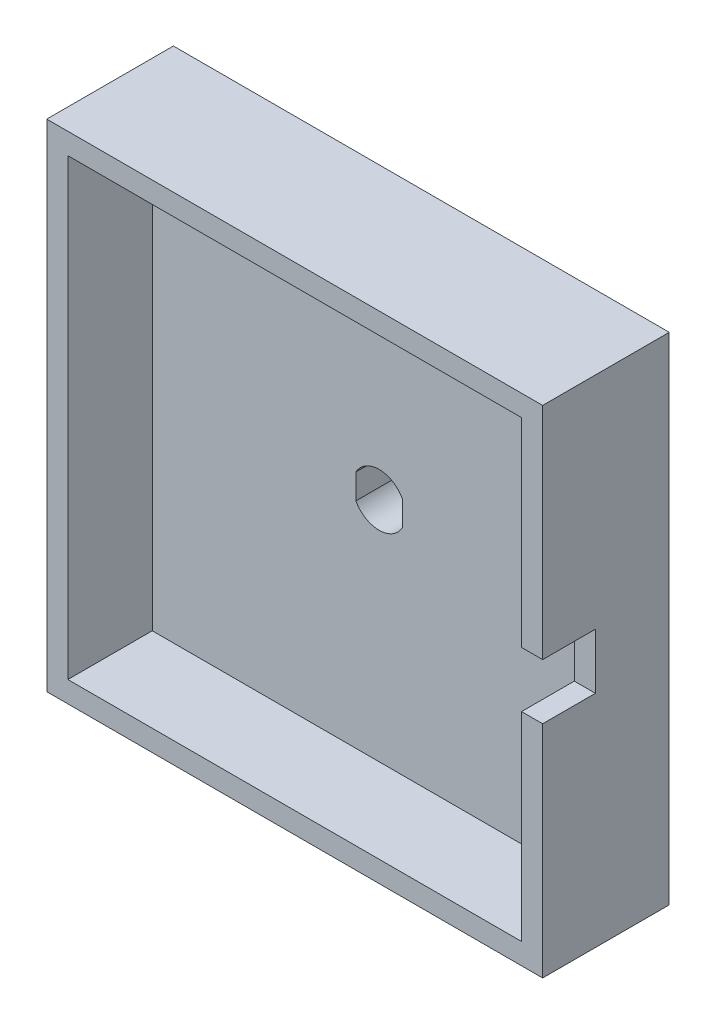
from build123d import *

# Parameters (mm, degrees)
SKETCH1_W               = 47
SKETCH1_H               = 47
BOSS_EXTRUDE1_DEPTH     = 4
CUT_EXTRUDE1_DEPTH      = 34.473870407
CUT_EXTRUDE1_DEPTH_BACK = 34.473870407
CUT_EXTRUDE2_DEPTH      = 34.473870407
CUT_EXTRUDE2_DEPTH_BACK = 34.473870407
SKETCH3_R               = 2.5
SKETCH4_W               = 47
SKETCH4_H               = 47
SKETCH4_W_2             = 43
SKETCH4_H_2             = 43
BOSS_EXTRUDE2_DEPTH     = 8
SKETCH5_W               = 2
SKETCH5_H               = 5.263518928
CUT_EXTRUDE3_DEPTH      = 5


with BuildPart() as part:
    # Sketch1 → Boss-Extrude1 (new body)
    with BuildSketch(Plane.XY):
        Rectangle(SKETCH1_W, SKETCH1_H)
    extrude(amount=BOSS_EXTRUDE1_DEPTH)

    # Sketch2 → Cut-Extrude1 (cut, two sides: drawn at the far end of the back side and taken through both)
    with BuildSketch(Plane.XY.offset(4).offset(-CUT_EXTRUDE1_DEPTH_BACK)):
        with BuildLine():
            Line((-2.2, 1.187434209), (-2.2, -1.187434209))
            ThreePointArc((-2.2, -1.187434209), (0, -2.5), (2.2, -1.187434209))
            Line((2.2, -1.187434209), (2.2, 1.187434209))
            ThreePointArc((2.2, 1.187434209), (0, 2.5), (-2.2, 1.187434209))
        make_face()
    extrude(amount=CUT_EXTRUDE1_DEPTH + CUT_EXTRUDE1_DEPTH_BACK, mode=Mode.SUBTRACT)

    # Sketch3 → Cut-Extrude2 (cut, two sides: drawn at the far end of the back side and taken through both)
    with BuildSketch(Plane.XY.offset(4).offset(-CUT_EXTRUDE2_DEPTH_BACK)):
        with Locations((-17.5, 17.5)):
            Circle(SKETCH3_R)
    extrude(amount=CUT_EXTRUDE2_DEPTH + CUT_EXTRUDE2_DEPTH_BACK, mode=Mode.SUBTRACT)

    # Sketch4 → Boss-Extrude2 (add)
    with BuildSketch(Plane.XY.offset(4)):
        Rectangle(SKETCH4_W, SKETCH4_H)
        Rectangle(SKETCH4_W_2, SKETCH4_H_2, mode=Mode.SUBTRACT)
    extrude(amount=BOSS_EXTRUDE2_DEPTH)

    # Sketch5 → Cut-Extrude3 (cut)
    with BuildSketch(Plane.XY.offset(12)):
        with Locations((22.5, 0)):
            Rectangle(SKETCH5_W, SKETCH5_H)
    extrude(amount=-CUT_EXTRUDE3_DEPTH, mode=Mode.SUBTRACT)


solid = part.part
